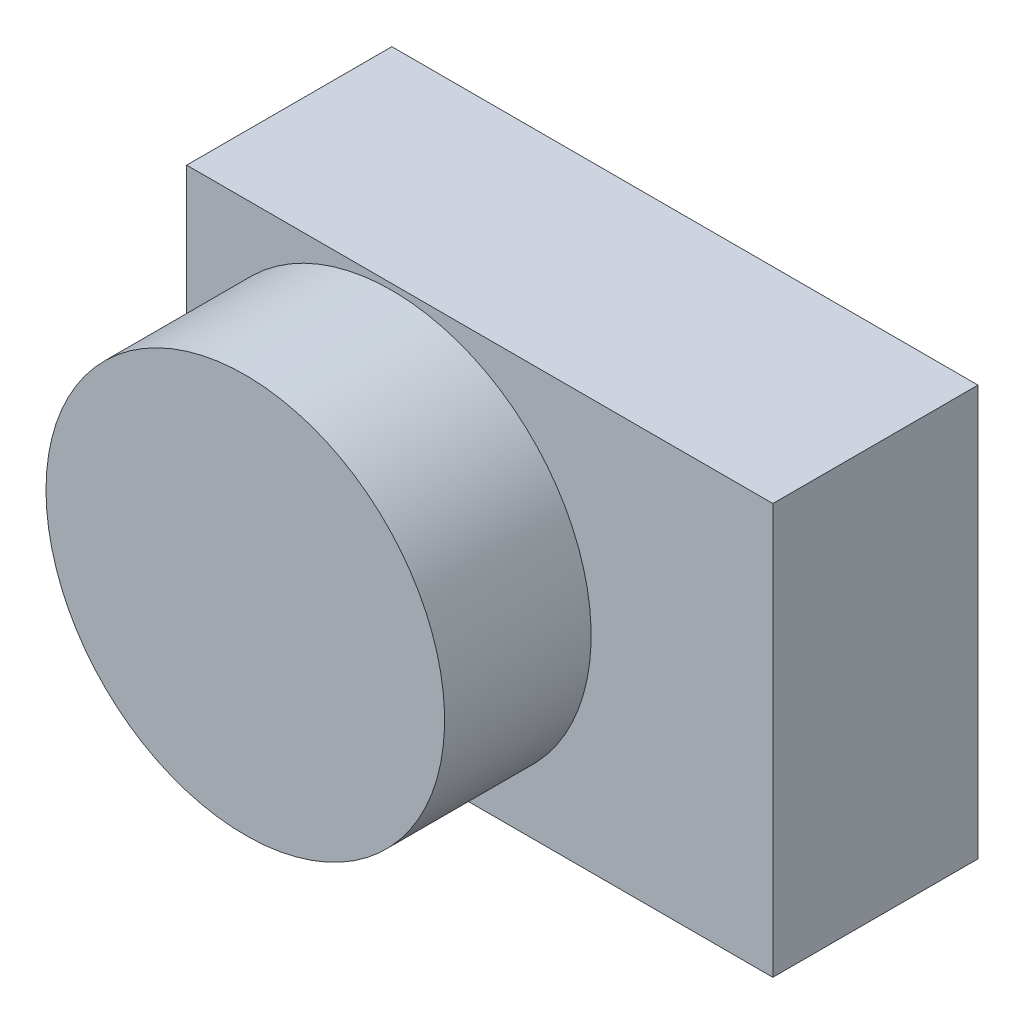
from build123d import *

# Parameters (mm, degrees)
SKETCH_1_W      = 100
SKETCH_1_H      = 70
EXTRUDE_1_DEPTH = 35
SKETCH_3_R      = 34
EXTRUDE_2_DEPTH = 60


with BuildPart() as part:
    # Эскиз1 → Бобышка-Вытянуть1 (new body)
    with BuildSketch(Plane.XY):
        Rectangle(SKETCH_1_W, SKETCH_1_H)
    extrude(amount=EXTRUDE_1_DEPTH)

    # Эскиз3 → Бобышка-Вытянуть2 (add)
    with BuildSketch(Plane(origin=(0, 0, 0), x_dir=(-1, 0, 0), z_dir=(0, 0, -1))):
        with Locations((15, 0)):
            Circle(SKETCH_3_R)
    extrude(amount=-EXTRUDE_2_DEPTH)


solid = part.part
